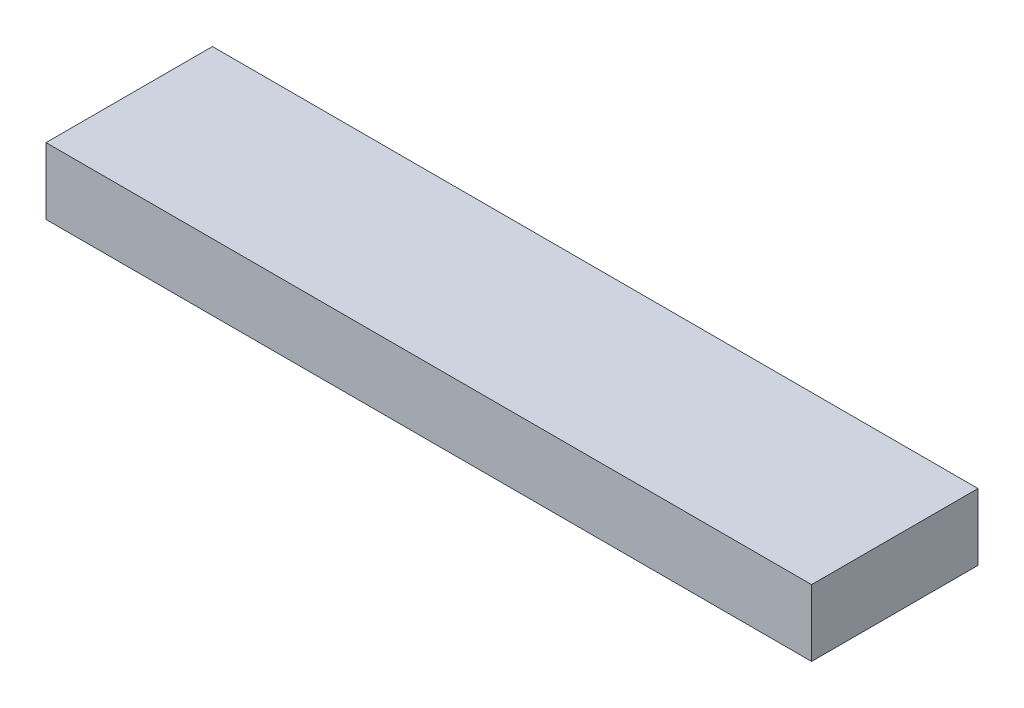
from build123d import *

# Parameters (mm, degrees)
SKETCH1_W      = 146.05
SKETCH1_H      = 12.7
EXTRUDE1_DEPTH = 31.75


with BuildPart() as part:
    # Sketch1 → Extrude1 (new body)
    with BuildSketch(Plane.XY):
        with Locations((73.025, -6.35)):
            Rectangle(SKETCH1_W, SKETCH1_H)
    extrude(amount=EXTRUDE1_DEPTH)


solid = part.part
